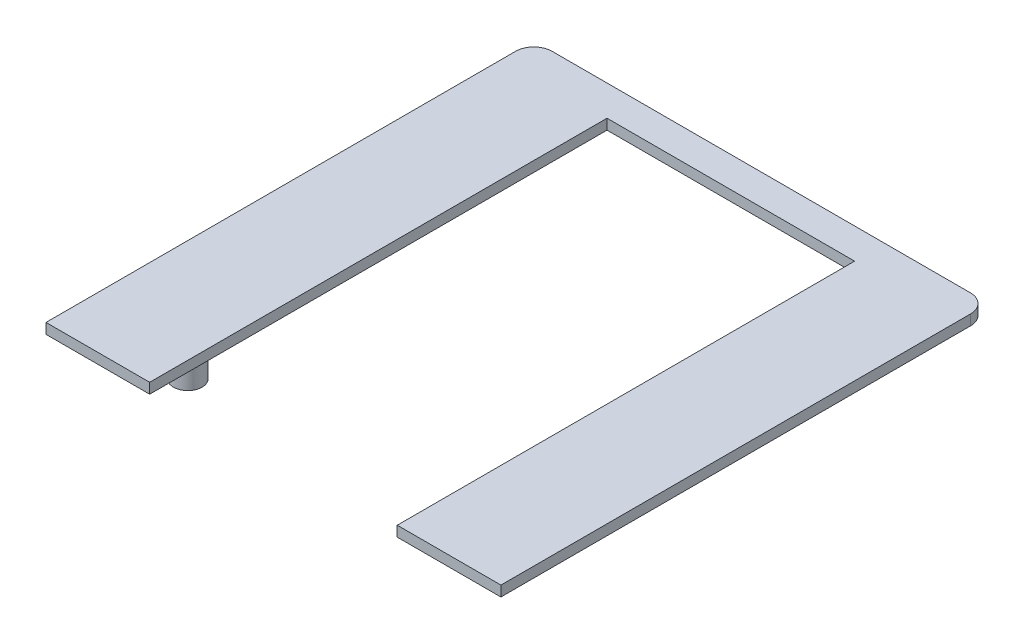
from build123d import *

# Parameters (mm, degrees)
BOSS_EXTRUDE1_DEPTH = 1.7
SKETCH2_R           = 2.35
BOSS_EXTRUDE2_DEPTH = 4.7
FILLET1_R           = 3
SKETCH3_R           = 2.4
CUT_EXTRUDE1_DEPTH  = 1


with BuildPart() as part:
    # Sketch1 → Boss-Extrude1 (new body)
    with BuildSketch(Plane(origin=(0, 0, 0), x_dir=(1, 0, 0), z_dir=(0, 1, 0))):
        Polygon((0, 0), (0, 80), (37.3, 80), (37.3, 75), (17, 75), (17, 0), align=None)
    extrude(amount=BOSS_EXTRUDE1_DEPTH)

    # Sketch2 → Boss-Extrude2 (add)
    with BuildSketch(Plane(origin=(0, 0, 0), x_dir=(-1, 0, 0), z_dir=(0, -1, 0))):
        with Locations(Location((-13.25, 10, 0), (0, 0, 90))):
            Circle(SKETCH2_R)
        with Locations(Location((-8, 72, 0), (0, 0, 90))):
            Circle(SKETCH2_R)
    extrude(amount=BOSS_EXTRUDE2_DEPTH)

    # Fillet1
    fillet1_edges = [part.edges().sort_by_distance(p)[0] for p in [
        (0, 0.85, -80),
    ]]
    fillet(fillet1_edges, radius=FILLET1_R)

    # Sketch3 → Cut-Extrude1 (cut)
    with BuildSketch(Plane(origin=(0, 0, 0), x_dir=(-1, 0, 0), z_dir=(0, -1, 0))):
        with Locations(Location((-13.25, 61.25, 0), (0, 0, 90))):
            Circle(SKETCH3_R)
    extrude(amount=-CUT_EXTRUDE1_DEPTH, mode=Mode.SUBTRACT)

    # Mirror3: part across plane


with BuildPart() as part_1:
    add(part.part)
    add(part.part.mirror(Plane(origin=(37.3, 1.7, -80), x_dir=(0, 0, 1), z_dir=(-1, 0, 0))))


solid = part_1.part
